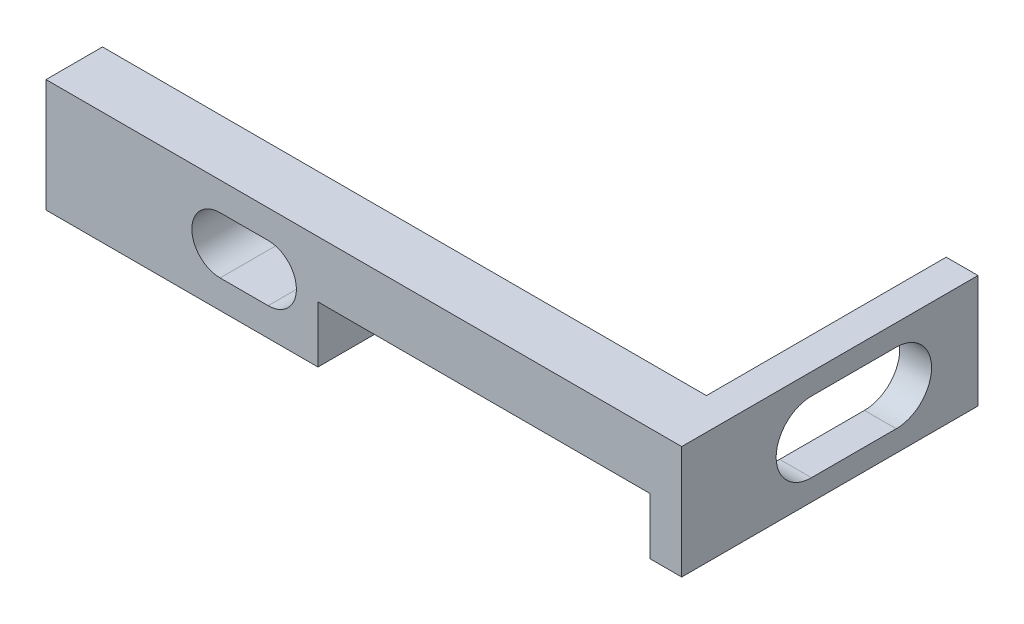
from build123d import *

# Parameters (mm, degrees)
SKETCH1_W           = 45
SKETCH1_H           = 25
BOSS_EXTRUDE1_DEPTH = 4
SKETCH5_W           = 40.5
SKETCH5_H           = 17
CUT_EXTRUDE2_DEPTH  = 27.048032555
SKETCH6_W           = 45
SKETCH6_H           = 4.025345596
CUT_EXTRUDE3_DEPTH  = 27.048032555
SKETCH13_W          = 2.25
SKETCH13_H          = 20.974654404
BOSS_EXTRUDE3_DEPTH = 8
SKETCH16_W          = 2.25
SKETCH16_H          = 20.974654404
BOSS_EXTRUDE4_DEPTH = 8
SKETCH19_W          = 17
SKETCH19_H          = 4
BOSS_EXTRUDE5_DEPTH = 4
SKETCH21_W          = 2.25
SKETCH21_H          = 16.974654404
CUT_EXTRUDE7_DEPTH  = 27.953663944
CUT_EXTRUDE9_DEPTH  = 47.874833333
CUT_EXTRUDE14_DEPTH = 32.019125187


with BuildPart() as part:
    # Sketch1 → Boss-Extrude1 (new body)
    with BuildSketch(Plane(origin=(0, 0, 0), x_dir=(1, 0, 0), z_dir=(0, 1, 0))):
        Rectangle(SKETCH1_W, SKETCH1_H)
    extrude(amount=BOSS_EXTRUDE1_DEPTH)

    # Sketch5 → Cut-Extrude2 (cut, through all)
    with BuildSketch(Plane(origin=(0, 4, 0), x_dir=(1, 0, 0), z_dir=(0, 1, 0))):
        Rectangle(SKETCH5_W, SKETCH5_H)
    extrude(amount=-CUT_EXTRUDE2_DEPTH, mode=Mode.SUBTRACT)

    # Sketch6 → Cut-Extrude3 (cut, through all)
    with BuildSketch(Plane(origin=(0, 4, 0), x_dir=(1, 0, 0), z_dir=(0, 1, 0))):
        with Locations((0, 10.487327202)):
            Rectangle(SKETCH6_W, SKETCH6_H)
    extrude(amount=-CUT_EXTRUDE3_DEPTH, mode=Mode.SUBTRACT)

    # Sketch13 → Boss-Extrude3 (add)
    with BuildSketch(Plane(origin=(0, 4, 0), x_dir=(1, 0, 0), z_dir=(0, 1, 0))):
        with Locations((21.375, -2.012672798)):
            Rectangle(SKETCH13_W, SKETCH13_H)
    extrude(amount=-BOSS_EXTRUDE3_DEPTH)

    # Sketch16 → Boss-Extrude4 (add)
    with BuildSketch(Plane(origin=(0, 4, 0), x_dir=(1, 0, 0), z_dir=(0, 1, 0))):
        with Locations((-21.375, -2.012672798)):
            Rectangle(SKETCH16_W, SKETCH16_H)
    extrude(amount=-BOSS_EXTRUDE4_DEPTH)

    # Sketch19 → Boss-Extrude5 (add)
    with BuildSketch(Plane.XZ):
        with Locations((11.75, 10.5)):
            Rectangle(SKETCH19_W, SKETCH19_H)
    extrude(amount=BOSS_EXTRUDE5_DEPTH)

    # Sketch21 → Cut-Extrude7 (cut, through all)
    with BuildSketch(Plane(origin=(0, 4, 0), x_dir=(1, 0, 0), z_dir=(0, 1, 0))):
        with Locations((21.375, -0.012672798)):
            Rectangle(SKETCH21_W, SKETCH21_H)
    extrude(amount=-CUT_EXTRUDE7_DEPTH, mode=Mode.SUBTRACT)

    # Sketch25 → Cut-Extrude9 (cut, through all)
    with BuildSketch(Plane.ZY.offset(22.5)):
        with BuildLine():
            Line((3.314549123, -2.5), (-2.685450877, -2.5))
            ThreePointArc((-2.685450877, -2.5), (-5.185450877, 0), (-2.685450877, 2.5))
            Line((-2.685450877, 2.5), (3.314549123, 2.5))
            ThreePointArc((3.314549123, 2.5), (5.814549123, 0), (3.314549123, -2.5))
        make_face()
    extrude(amount=-CUT_EXTRUDE9_DEPTH, mode=Mode.SUBTRACT)

    # Sketch29 → Cut-Extrude14 (cut, through all)
    with BuildSketch(Plane.XY.offset(12.5)):
        with BuildLine():
            Line((6.774762471, 2), (10.174762471, 2))
            ThreePointArc((10.174762471, 2), (12.174762471, 0), (10.174762471, -2))
            Line((10.174762471, -2), (6.774762471, -2))
            ThreePointArc((6.774762471, -2), (4.774762471, 0), (6.774762471, 2))
        make_face()
    extrude(amount=-CUT_EXTRUDE14_DEPTH, mode=Mode.SUBTRACT)


with BuildPart() as body_2:
    # Mirror1: mirrored copy
    add(part.part.mirror(Plane(origin=(22.5, 4, -12.5), x_dir=(0, 0, 1), z_dir=(-1, 0, 0))))


solid = body_2.part
